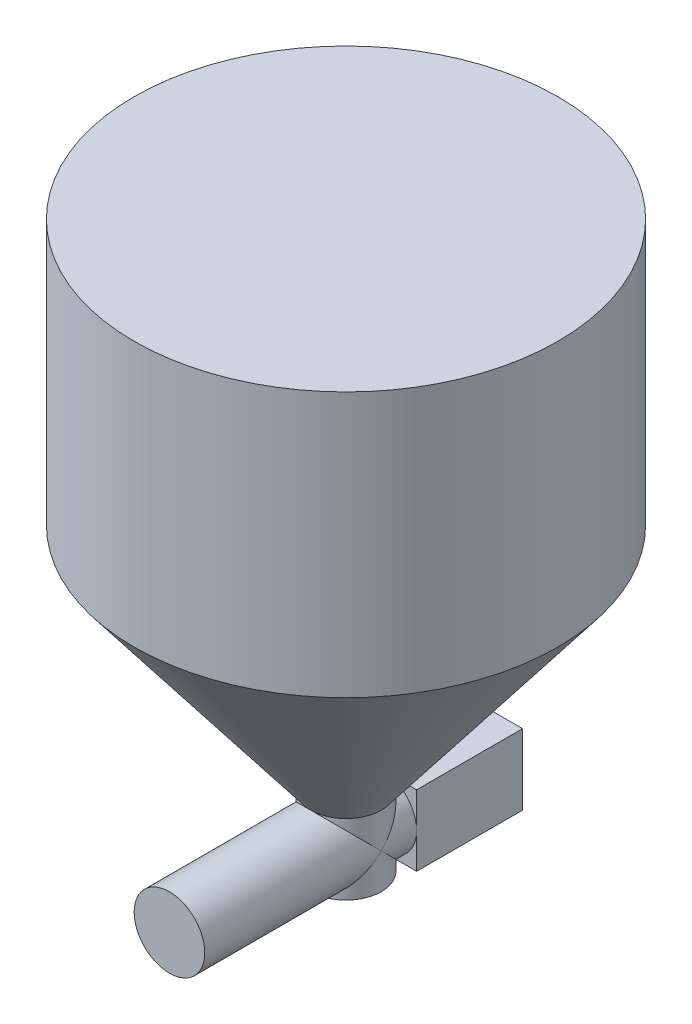
from build123d import *

# Parameters (mm, degrees)
CROQUIS1_R              = 300
SALIENTE_EXTRUIR1_DEPTH = 375
CROQUIS3_R              = 50
CROQUIS2_R              = 300
CROQUIS4_R              = 50
SALIENTE_EXTRUIR2_DEPTH = 100
CROQUIS5_R              = 50
SALIENTE_EXTRUIR3_DEPTH = 300
CROQUIS6_W              = 100
CROQUIS6_H              = 100
SALIENTE_EXTRUIR4_DEPTH = 150


with BuildPart() as part:
    # Croquis1 → Saliente-Extruir1 (new body)
    with BuildSketch(Plane(origin=(0, 0, 0), x_dir=(1, 0, 0), z_dir=(0, 1, 0))):
        with Locations(Location((0, 0, 0), (0, 0, 270))):
            Circle(CROQUIS1_R)
    extrude(amount=-SALIENTE_EXTRUIR1_DEPTH)

    # Croquis3 → Recubrir1 section 0
    with BuildSketch(Plane(origin=(0, -700, 0), x_dir=(1, 0, 0), z_dir=(0, 1, 0))):
        Circle(CROQUIS3_R)
    # Croquis2 → Recubrir1 section 1
    with BuildSketch(Plane.XZ.offset(375)):
        Circle(CROQUIS2_R)
    loft()

    # Croquis4 → Saliente-Extruir2 (add)
    with BuildSketch(Plane.XZ.offset(700)):
        with Locations(Location((0, 0, 0), (0, 0, 270))):
            Circle(CROQUIS4_R)
    extrude(amount=SALIENTE_EXTRUIR2_DEPTH)

    # Croquis5 → Saliente-Extruir3 (add)
    with BuildSketch(Plane(origin=(0, 0, -50), x_dir=(-1, 0, 0), z_dir=(0, 0, -1))):
        with Locations((0, -750)):
            Circle(CROQUIS5_R)
    extrude(amount=-SALIENTE_EXTRUIR3_DEPTH)

    # Croquis6 → Saliente-Extruir4 (add)
    with BuildSketch(Plane(origin=(0, 0, -50), x_dir=(-1, 0, 0), z_dir=(0, 0, -1))):
        with Locations((0, -750)):
            Rectangle(CROQUIS6_W, CROQUIS6_H)
    extrude(amount=SALIENTE_EXTRUIR4_DEPTH)


solid = part.part
